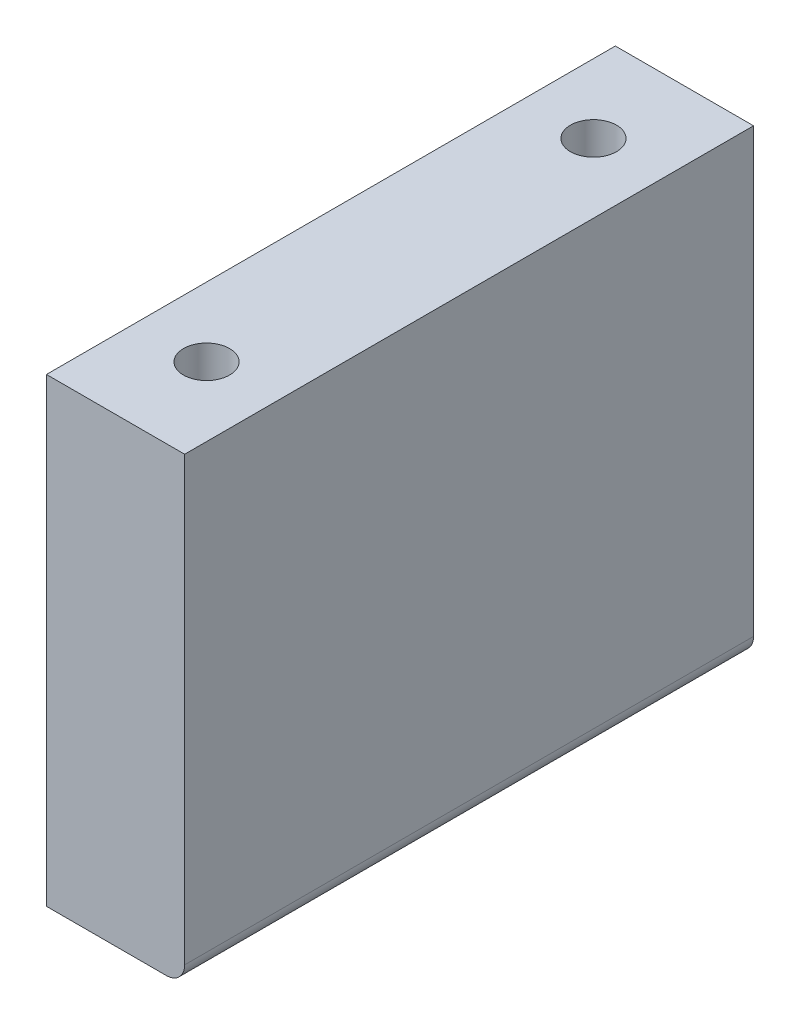
from build123d import *

# Parameters (mm, degrees)
SKETCH1_W             = 15
SKETCH1_H             = 50
BOSS_EXTRUDE1_DEPTH   = 30.875
FILLET1_R             = 2
M6_TAPPED_HOLE1_D     = 5
M6_TAPPED_HOLE1_DEPTH = 17
M6_TAPPED_HOLE1_TIP   = 1.502151548


with BuildPart() as part:
    # Sketch1 → Boss-Extrude1 (new, symmetric)
    with BuildSketch(Plane.XY):
        with Locations((0, -25)):
            Rectangle(SKETCH1_W, SKETCH1_H)
    extrude(amount=BOSS_EXTRUDE1_DEPTH, both=True)

    # Fillet1
    fillet1_edges = [part.edges().sort_by_distance(p)[0] for p in [
        (7.5, -50, 0),
    ]]
    fillet(fillet1_edges, radius=FILLET1_R)

    # M6 Tapped Hole1
    with Locations(Plane(origin=(0, 0, 0), x_dir=(1, 0, 0), z_dir=(0, 1, 0))):
        with Locations((0, 21), (0, -21)):
            Hole(M6_TAPPED_HOLE1_D / 2, depth=M6_TAPPED_HOLE1_DEPTH)
            with Locations((0, 0, -(M6_TAPPED_HOLE1_DEPTH + M6_TAPPED_HOLE1_TIP / 2))):  # 118° drill point
                Cone(0, M6_TAPPED_HOLE1_D / 2, M6_TAPPED_HOLE1_TIP, mode=Mode.SUBTRACT)


solid = part.part
